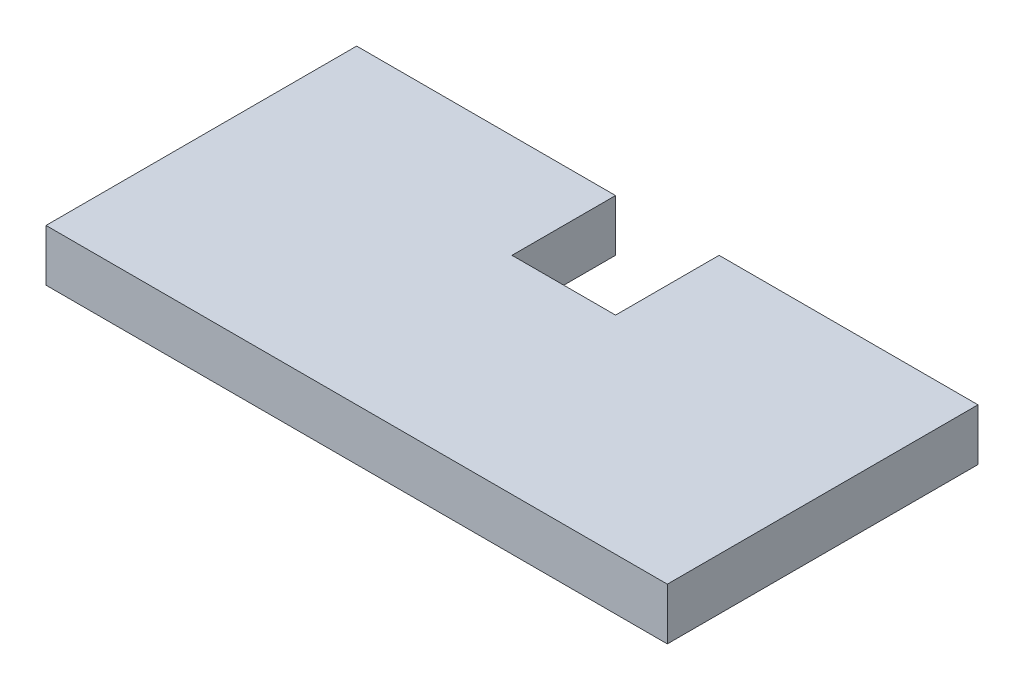
from build123d import *

# Parameters (mm, degrees)
SKETCH1_W           = 600
SKETCH1_H           = 300
BOSS_EXTRUDE1_DEPTH = 50
SKETCH2_W           = 100
SKETCH2_H           = 50
CUT_EXTRUDE1_DEPTH  = 100


with BuildPart() as part:
    # Sketch1 → Boss-Extrude1 (new body)
    with BuildSketch(Plane(origin=(0, 0, 0), x_dir=(1, 0, 0), z_dir=(0, 1, 0))):
        with Locations((-216.052613816, 220.540919523)):
            Rectangle(SKETCH1_W, SKETCH1_H)
    extrude(amount=BOSS_EXTRUDE1_DEPTH)

    # Sketch2 → Cut-Extrude1 (cut)
    with BuildSketch(Plane(origin=(0, 0, -370.540919523), x_dir=(-1, 0, 0), z_dir=(0, 0, -1))):
        with Locations((216.052613816, 25)):
            Rectangle(SKETCH2_W, SKETCH2_H)
    extrude(amount=-CUT_EXTRUDE1_DEPTH, mode=Mode.SUBTRACT)


solid = part.part
